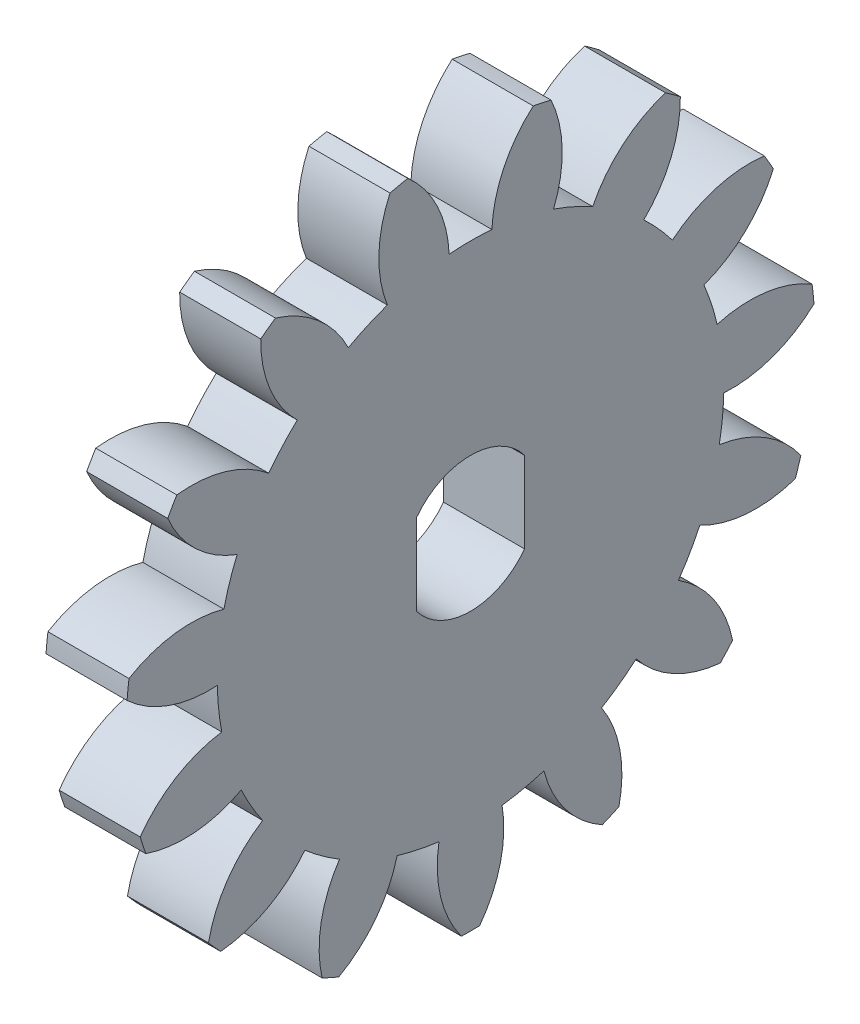
from build123d import *

# Parameters (mm, degrees)
BASPROSKE_W        = 3
BASPROSKE_H        = 12.75
TOOTHCUT_DEPTH     = 19.27908641
TEETHCUTS_COUNT    = 15
TEETHCUTS_ANGLE    = 336
BORSKE_R           = 2.5
BORE_DEPTH         = 50.0000508
BOSS_EXTRU_1_DEPTH = 3


with BuildPart() as part:
    # BasProSke → Base-Revolve (revolve)
    with BuildSketch(Plane(origin=(0, 0, 0), x_dir=(1, 0, 0), z_dir=(0, 1, 0)), mode=Mode.PRIVATE) as base_revolve_sk:
        with Locations((1.5, 6.375)):
            Rectangle(BASPROSKE_W, BASPROSKE_H)
    revolve(base_revolve_sk.sketch.rotate(Axis((-10, 0, 0), (1, 0, 0)), 180), axis=Axis((-10, 0, 0), (1, 0, 0)))

    # TooCutSke → ToothCut (cut, through all)
    with BuildSketch(Plane(origin=(0, 0, 0), x_dir=(0, 0, -1), z_dir=(1, 0, 0))):
        with BuildLine():
            ThreePointArc((0.791546546, 9.340520867), (0, 9.374), (-0.791546546, 9.340520867))
            ThreePointArc((-0.791546546, 9.340520867), (-1.235070734, 11.110218102), (-2.344732916, 12.558386549))
            ThreePointArc((-2.344732916, 12.558386549), (0, 12.7754), (2.344732916, 12.558386549))
            ThreePointArc((2.344732916, 12.558386549), (1.235070734, 11.110218102), (0.791546546, 9.340520867))
        make_face()
    toothcut = extrude(amount=TOOTHCUT_DEPTH, mode=Mode.SUBTRACT)

    # TeethCuts: ToothCut ×15 about axis
    teethcuts_axis = Axis((-10, 0, 0), (1, 0, 0))
    for i in range(1, TEETHCUTS_COUNT):
        add(toothcut.rotate(teethcuts_axis, i * TEETHCUTS_ANGLE / (TEETHCUTS_COUNT - 1)), mode=Mode.SUBTRACT)

    # BorSke → Bore (cut, symmetric)
    with BuildSketch(Plane(origin=(0, 0, 0), x_dir=(0, 0, -1), z_dir=(1, 0, 0))):
        with Locations(Location((0, 0, 0), (0, 0, 180))):
            Circle(BORSKE_R)
    extrude(amount=BORE_DEPTH, both=True, mode=Mode.SUBTRACT)

    # Esquisse1 → Boss.-Extru.1 (add)
    with BuildSketch(Plane(origin=(3, 0, 0), x_dir=(0, 0, -1), z_dir=(1, 0, 0))):
        with BuildLine():
            Line((-2, 1.5), (-2, -1.5))
            ThreePointArc((-2, -1.5), (-2.5, 0), (-2, 1.5))
        make_face()
        with BuildLine():
            Line((2, 1.5), (2, -1.5))
            ThreePointArc((2, -1.5), (2.5, 0), (2, 1.5))
        make_face()
    extrude(amount=-BOSS_EXTRU_1_DEPTH)


solid = part.part
